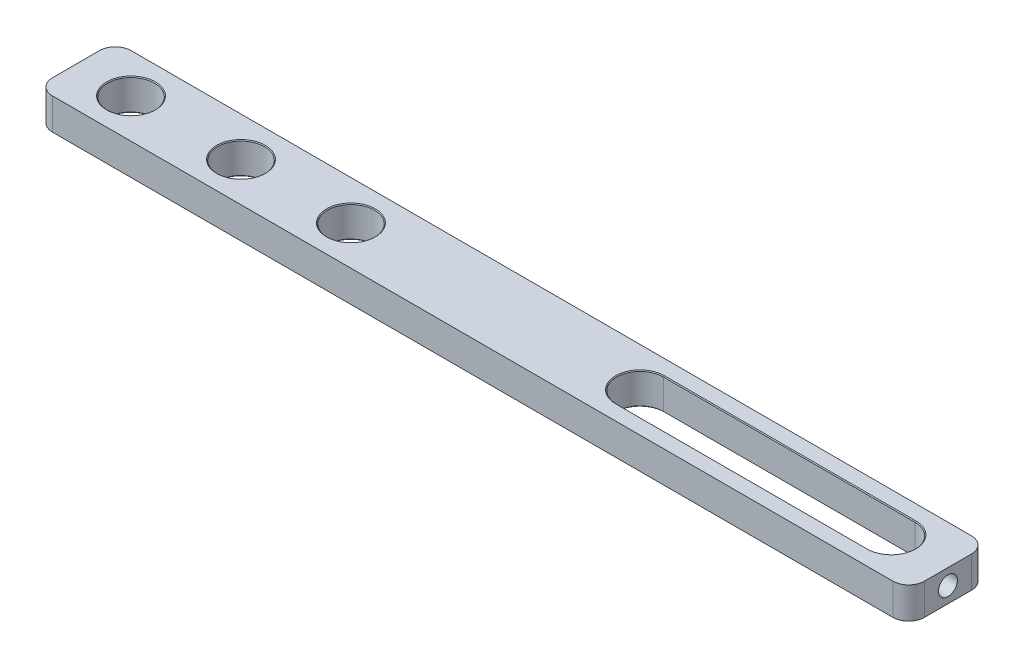
from build123d import *

# Parameters (mm, degrees)
SKETCH_1_W               = 555
SKETCH_1_H               = 50
EXTRUDE_1_DEPTH          = 20
SKETCH_2_R               = 15
CUT_EXTRUDE_1_DEPTH      = 280.340741747
CUT_EXTRUDE_2_REACH      = 557.923
CUT_EXTRUDE_2_END_RADIUS = 15
SKETCH_3_R               = 6
FILLET_1_R               = 10
CHAMFER_1_SIZE           = 0.5


with BuildPart() as part:
    # 草图1 → 凸台-拉伸1 (new body)
    with BuildSketch(Plane(origin=(0, 0, 0), x_dir=(1, 0, 0), z_dir=(0, 1, 0))):
        Rectangle(SKETCH_1_W, SKETCH_1_H)
    extrude(amount=EXTRUDE_1_DEPTH)

    # 草图2 → 切除-拉伸1 (cut, through all)
    with BuildSketch(Plane(origin=(0, 20, 0), x_dir=(1, 0, 0), z_dir=(0, 1, 0))):
        with Locations(Location((-242.5, 0, 0), (0, 0, 270))):
            Circle(SKETCH_2_R)
        with Locations(Location((-172.5, 0, 0), (0, 0, 270))):
            Circle(SKETCH_2_R)
        with Locations(Location((-102.5, 0, 0), (0, 0, 270))):
            Circle(SKETCH_2_R)
        with BuildLine():
            Line((81.5, 15), (241.5, 15))
            ThreePointArc((241.5, 15), (256.5, 0), (241.5, -15))
            Line((241.5, -15), (81.5, -15))
            ThreePointArc((81.5, -15), (66.5, 0), (81.5, 15))
        make_face()
    extrude(amount=-CUT_EXTRUDE_1_DEPTH, mode=Mode.SUBTRACT)

    # 切除-拉伸2: up to this cylinder (the profile starts outside it)
    cut_extrude_2_end = Plane(origin=(241.5, 10, 0), z_dir=(0, 1, 0)) * Cylinder(CUT_EXTRUDE_2_END_RADIUS, 1146.846, mode=Mode.PRIVATE)
    # 草图3 → 切除-拉伸2 (cut, up to the surface)
    with BuildSketch(Plane(origin=(277.5, 0, 0), x_dir=(0, 0, -1), z_dir=(1, 0, 0)), mode=Mode.PRIVATE) as cut_extrude_2_sk1:
        with Locations((0, 10)):
            Circle(SKETCH_3_R)
    cut_extrude_2_tool1 = extrude(cut_extrude_2_sk1.sketch, amount=-CUT_EXTRUDE_2_REACH, mode=Mode.PRIVATE) - cut_extrude_2_end
    add(cut_extrude_2_tool1.solids().sort_by_distance((277.5, 10, 0))[0], mode=Mode.SUBTRACT)

    # 圆角1
    fillet_1_edges = [part.edges().sort_by_distance(p)[0] for p in [
        (-277.5, 10, -25),
        (277.5, 10, -25),
        (277.5, 10, 25),
        (-277.5, 10, 25),
    ]]
    fillet(fillet_1_edges, radius=FILLET_1_R)

    # 倒角1
    chamfer_1_edges = [part.edges().sort_by_distance(p)[0] for p in [
        (-242.5, 0, -15),
        (-242.5, 20, -15),
        (-172.5, 0, -15),
        (-172.5, 20, -15),
        (-102.5, 0, -15),
        (-102.5, 20, -15),
        (66.5, 0, 0),
        (161.5, 0, -15),
        (256.5, 0, 0),
        (161.5, 0, 15),
        (66.5, 20, 0),
        (161.5, 20, 15),
        (256.5, 20, 0),
        (161.5, 20, -15),
    ]]
    chamfer(chamfer_1_edges, length=CHAMFER_1_SIZE)


solid = part.part
